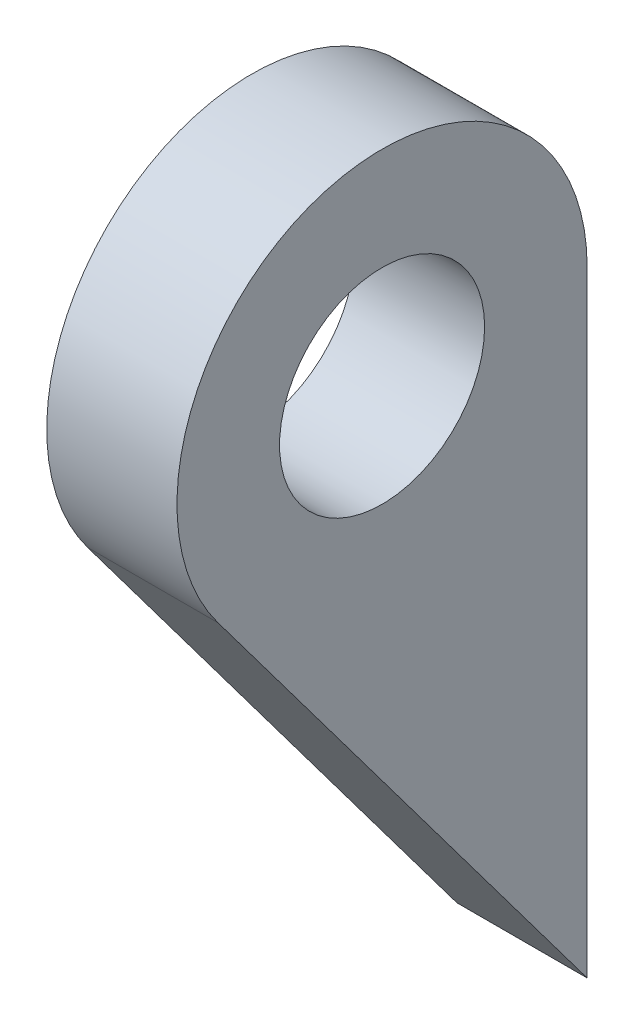
from build123d import *

# Parameters (mm, degrees)
SKETCH2_R           = 2.5
BOSS_EXTRUDE3_DEPTH = 1.5875


with BuildPart() as part:
    # Sketch2 → Boss-Extrude3 (new, symmetric)
    with BuildSketch(Plane(origin=(0, 0, 0), x_dir=(0, 0, -1), z_dir=(1, 0, 0))):
        with BuildLine():
            Line((-9.002260878, 2), (-0.002260878, -10))
            Line((-0.002260878, -10), (-0.002260878, 5))
            ThreePointArc((-0.002260878, 5), (-6.583399709, 9.74341649), (-9.002260878, 2))
        make_face()
        with Locations((-5.002260878, 5)):
            Circle(SKETCH2_R, mode=Mode.SUBTRACT)
    extrude(amount=BOSS_EXTRUDE3_DEPTH, both=True)


solid = part.part
